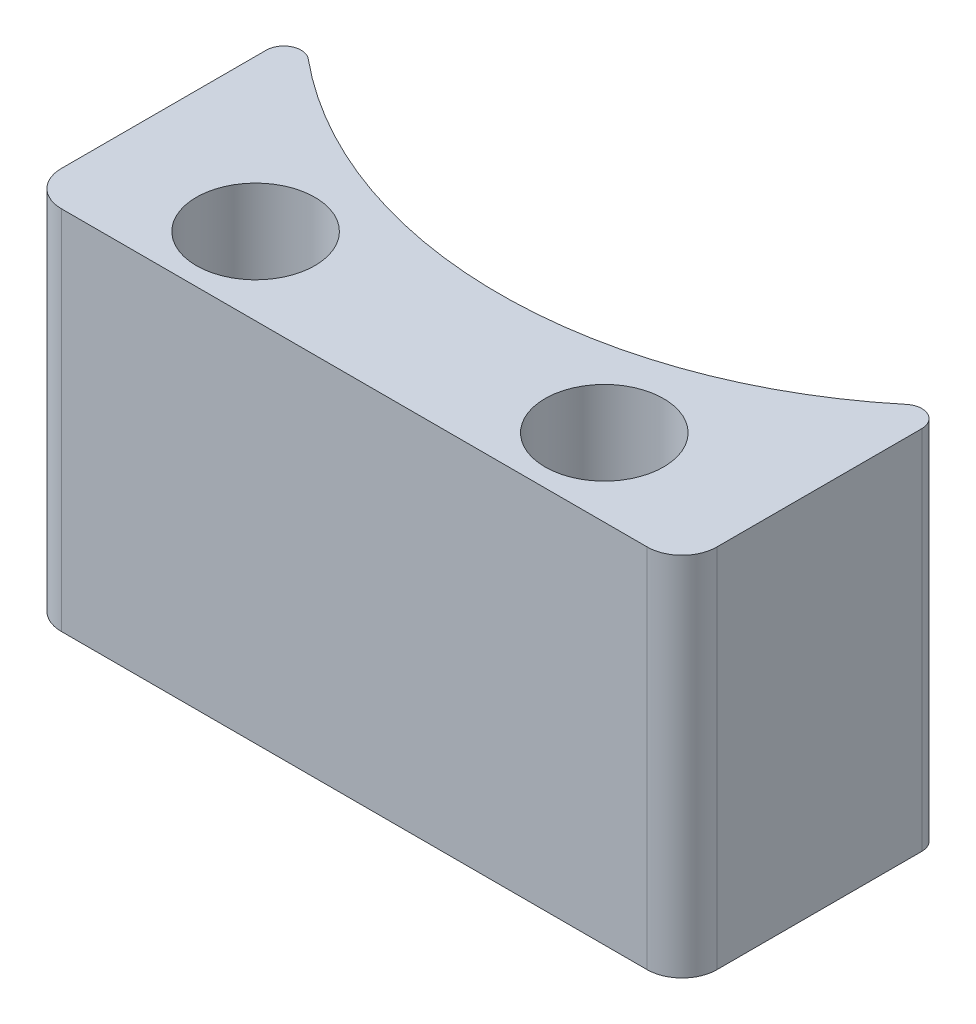
from build123d import *

# Parameters (mm, degrees)
EXTRUDE_1_DEPTH   = 10.5
FILLET_1_R        = 1
HOLE_WIZARD_M31_D = 3.4
FILLET_2_R        = 0.5


with BuildPart() as part:
    # Эскиз1 → Бобышка-Вытянуть1 (new body)
    with BuildSketch(Plane(origin=(0, 0, 0), x_dir=(1, 0, 0), z_dir=(0, 1, 0))):
        with BuildLine():
            Line((0, 0), (0, -8))
            Line((0, -8), (18.8, -8))
            Line((18.8, -8), (18.8, 0))
            ThreePointArc((18.8, 0), (9.4, -3.835773145), (0, 0))
        make_face()
    extrude(amount=EXTRUDE_1_DEPTH)

    # Скругление1
    fillet_1_edges = [part.edges().sort_by_distance(p)[0] for p in [
        (18.8, 5.25, 8),
        (0, 5.25, 8),
    ]]
    fillet(fillet_1_edges, radius=FILLET_1_R)

    # Отверстие с зазором M31 (through all)
    with Locations(Plane(origin=(0, 10.5, 0), x_dir=(1, 0, 0), z_dir=(0, 1, 0))):
        with Locations((4.350247301, -5.779226371), (14.350247301, -5.779226371)):
            Hole(HOLE_WIZARD_M31_D / 2)

    # Скругление2
    fillet_2_edges = [part.edges().sort_by_distance(p)[0] for p in [
        (18.8, 5.25, 0),
        (0, 5.25, 0),
    ]]
    fillet(fillet_2_edges, radius=FILLET_2_R)


solid = part.part
